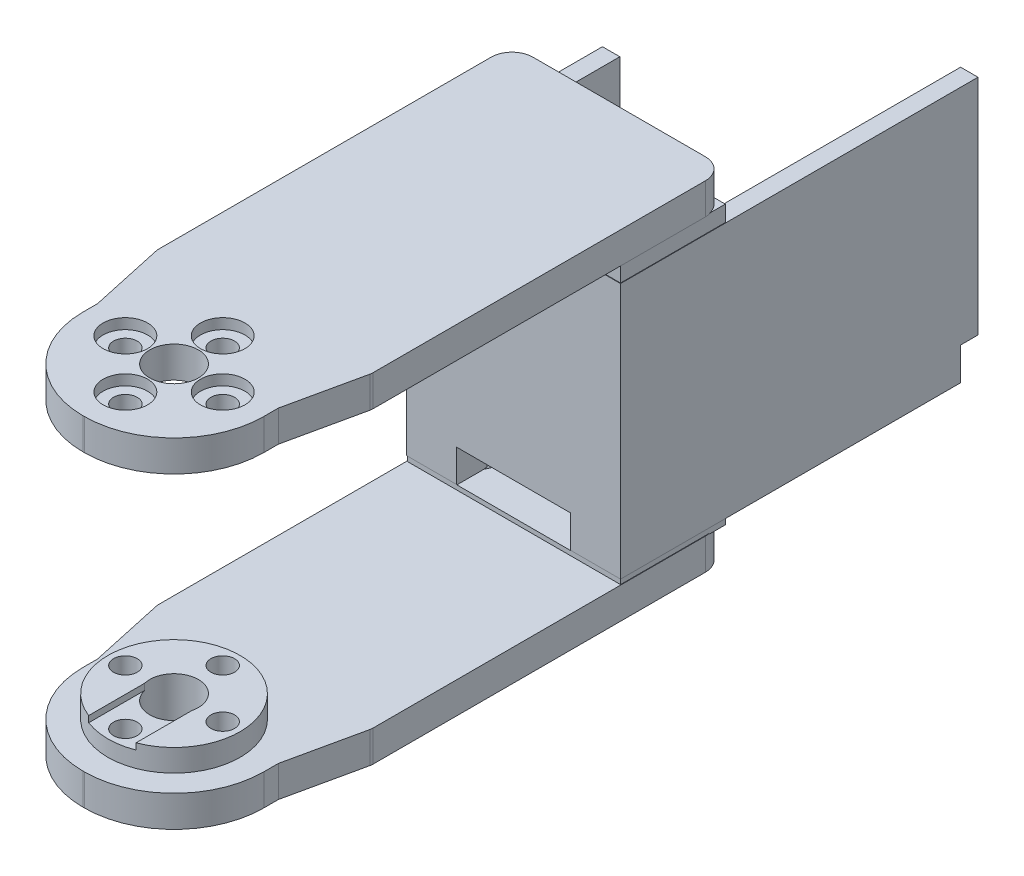
from build123d import *

# Parameters (mm, degrees)
BOSS_1_DEPTH    = 4.5
S_CYL2_R        = 9.5
BOSS_2_DEPTH    = 3.2
BOSS_3_DEPTH    = 4.5
S_BOX4_W        = 30.8
S_BOX4_H        = 36.8
BOSS_4_DEPTH    = 2.5
S_BOX5_W        = 2.5
S_BOX5_H        = 36.8
BOSS_5_DEPTH    = 51.4
S_BOX6_W        = 30.8
S_BOX6_H        = 4.6
BOSS_6_DEPTH    = 51.4
S_BOX7_W        = 2.5
S_BOX7_H        = 36.8
BOSS_7_DEPTH    = 28.2
S_BOX8_W        = 30.66
S_BOX8_H        = 2.4
BOSS_8_DEPTH    = 15.06
S_BOX9_W        = 30.66
S_BOX9_H        = 0.95
BOSS_9_DEPTH    = 15.06
S_HOLE10_R      = 3.5
HOLE_10_DEPTH   = 4.7
S_HOLE11_R      = 1.7
HOLE_11_DEPTH   = 4.7
S_HOLE12_R      = 1.7
HOLE_12_DEPTH   = 4.7
S_HOLE13_R      = 1.7
HOLE_13_DEPTH   = 4.7
S_HOLE14_R      = 1.7
HOLE_14_DEPTH   = 4.7
S_HOLE15_R      = 3.2
HOLE_15_DEPTH   = 1.6
S_HOLE16_R      = 3.2
HOLE_16_DEPTH   = 1.6
S_HOLE17_R      = 3.2
HOLE_17_DEPTH   = 1.6
S_HOLE18_R      = 3.2
HOLE_18_DEPTH   = 1.6
S_HOLE19_R      = 3.5
HOLE_19_DEPTH   = 7.9
S_HOLE20_R      = 1.7
HOLE_20_DEPTH   = 7.9
S_HOLE21_R      = 1.7
HOLE_21_DEPTH   = 7.9
S_HOLE22_R      = 1.7
HOLE_22_DEPTH   = 7.9
S_HOLE23_R      = 1.7
HOLE_23_DEPTH   = 7.9
S_HOLE24_R      = 3.2
HOLE_24_DEPTH   = 2.1
S_HOLE25_R      = 3.2
HOLE_25_DEPTH   = 2.1
S_HOLE26_R      = 3.2
HOLE_26_DEPTH   = 2.1
S_HOLE27_R      = 3.2
HOLE_27_DEPTH   = 2.1
S_CUT28_W       = 6.8
S_CUT28_H       = 1
POCKET_28_DEPTH = 10
S_HOLE29_R      = 10.5
HOLE_29_DEPTH   = 4.8
S_CUT30_W       = 19.4
S_CUT30_H       = 4.75
POCKET_30_DEPTH = 19.5
S_CUT31_W       = 16.4
S_CUT31_H       = 4.75
POCKET_31_DEPTH = 8.3
S_CUT32_W       = 7
S_CUT32_H       = 4.75
POCKET_32_DEPTH = 11
S_CUT33_W       = 20
S_CUT33_H       = 2.9
POCKET_33_DEPTH = 13.7
S_HOLE34_R      = 1.1
HOLE_34_DEPTH   = 4.8
S_HOLE35_R      = 2.3
HOLE_35_DEPTH   = 1.7
S_HOLE36_R      = 1.1
HOLE_36_DEPTH   = 4.8
S_HOLE37_R      = 2.3
HOLE_37_DEPTH   = 1.7
S_CUT38_W       = 31
S_CUT38_H       = 4.8
POCKET_38_DEPTH = 2.6
S_CUT39_W       = 19
S_CUT39_H       = 4.75
POCKET_39_DEPTH = 22.2
S_CUT40_W       = 15
S_CUT40_H       = 1.55
POCKET_40_DEPTH = 27.4
S_HOLE41_R      = 2.5
HOLE_41_DEPTH   = 5.3
S_HOLE42_R      = 2.5
HOLE_42_DEPTH   = 5.3


with BuildPart() as part:
    # S_prism1 → Boss_1 (new body)
    with BuildSketch(Plane(origin=(0, 18.8, 0), x_dir=(1, 0, 0), z_dir=(0, 1, 0))):
        with BuildLine():
            Line((-13, 2), (-15.354, 12.7893))
            ThreePointArc((-15.354, 12.7893), (-15.38850097, 13.001208985), (-15.4, 13.2156))
            Line((-15.4, 13.2156), (-15.4, 61))
            ThreePointArc((-15.4, 61), (-14.5213, 63.1213), (-12.4, 64))
            Line((-12.4, 64), (12.4, 64))
            ThreePointArc((12.4, 64), (14.5213, 63.1213), (15.4, 61))
            Line((15.4, 61), (15.4, 13.2156))
            ThreePointArc((15.4, 13.2156), (15.38850097, 13.001208985), (15.354, 12.7893))
            Line((15.354, 12.7893), (13, 2))
            Line((13, 2), (13, -0.1))
            ThreePointArc((13, -0.1), (9.2217, -9.2217), (0.1, -13))
            Line((0.1, -13), (-0.1, -13))
            ThreePointArc((-0.1, -13), (-9.2217, -9.2217), (-13, -0.1))
            Line((-13, -0.1), (-13, 2))
        make_face()
    extrude(amount=BOSS_1_DEPTH)



with BuildPart() as body_2:
    # S_cyl2 → Boss_2 (new body)
    with BuildSketch(Plane(origin=(0, -20.95, 0), x_dir=(1, 0, 0), z_dir=(0, 1, 0))):
        with Locations(Location((0, 0, 0), (0, 0, 270))):
            Circle(S_CYL2_R)
    extrude(amount=BOSS_2_DEPTH)

    # S_prism3 → Boss_3 (add)
    with BuildSketch(Plane(origin=(0, -25.45, 0), x_dir=(1, 0, 0), z_dir=(0, 1, 0))):
        with BuildLine():
            Line((-13, 2), (-15.354, 12.7893))
            ThreePointArc((-15.354, 12.7893), (-15.38850097, 13.001208985), (-15.4, 13.2156))
            Line((-15.4, 13.2156), (-15.4, 61))
            ThreePointArc((-15.4, 61), (-14.5213, 63.1213), (-12.4, 64))
            Line((-12.4, 64), (12.4, 64))
            ThreePointArc((12.4, 64), (14.5213, 63.1213), (15.4, 61))
            Line((15.4, 61), (15.4, 13.2156))
            ThreePointArc((15.4, 13.2156), (15.38850097, 13.001208985), (15.354, 12.7893))
            Line((15.354, 12.7893), (13, 2))
            Line((13, 2), (13, -0.1))
            ThreePointArc((13, -0.1), (9.2217, -9.2217), (0.1, -13))
            Line((0.1, -13), (-0.1, -13))
            ThreePointArc((-0.1, -13), (-9.2217, -9.2217), (-13, -0.1))
            Line((-13, -0.1), (-13, 2))
        make_face()
    extrude(amount=BOSS_3_DEPTH)


with BuildPart() as body_3:
    # S_box4 → Boss_4 (new body)
    with BuildSketch(Plane.XY.offset(-51.3)):
        with Locations((0, -1.8)):
            Rectangle(S_BOX4_W, S_BOX4_H)
    extrude(amount=BOSS_4_DEPTH)

    # S_box5 → Boss_5 (add)
    with BuildSketch(Plane.XY.offset(-100.2)):
        with Locations((14.15, -1.8)):
            Rectangle(S_BOX5_W, S_BOX5_H)
    extrude(amount=BOSS_5_DEPTH)

    # S_box6 → Boss_6 (add)
    with BuildSketch(Plane.XY.offset(-100.2)):
        with Locations((0, -17.9)):
            Rectangle(S_BOX6_W, S_BOX6_H)
    extrude(amount=BOSS_6_DEPTH)

    # S_box7 → Boss_7 (add)
    with BuildSketch(Plane.XY.offset(-77)):
        with Locations((-14.15, -1.8)):
            Rectangle(S_BOX7_W, S_BOX7_H)
    extrude(amount=BOSS_7_DEPTH)


with BuildPart() as part_1:
    add(part.part)

    add(body_3.part)  # Boss_8 merges body 3
    # S_box8 → Boss_8 (add)
    with BuildSketch(Plane.XY.offset(-63.93)):
        with Locations((0, 17.7)):
            Rectangle(S_BOX8_W, S_BOX8_H)
    extrude(amount=BOSS_8_DEPTH)


    add(body_2.part)  # Boss_9 merges body 2
    # S_box9 → Boss_9 (add)
    with BuildSketch(Plane.XY.offset(-63.93)):
        with Locations((0, -20.575)):
            Rectangle(S_BOX9_W, S_BOX9_H)
    extrude(amount=BOSS_9_DEPTH)

    # S_hole10 → Hole_10 (cut)
    with BuildSketch(Plane(origin=(0, 18.7, 0), x_dir=(1, 0, 0), z_dir=(0, 1, 0))):
        with Locations(Location((0, 0, 0), (0, 0, 90))):
            Circle(S_HOLE10_R)
    extrude(amount=HOLE_10_DEPTH, mode=Mode.SUBTRACT)

    # S_hole11 → Hole_11 (cut)
    with BuildSketch(Plane(origin=(0, 18.7, 0), x_dir=(1, 0, 0), z_dir=(0, 1, 0))):
        with Locations(Location((7, 0, 0), (0, 0, 90))):
            Circle(S_HOLE11_R)
    extrude(amount=HOLE_11_DEPTH, mode=Mode.SUBTRACT)

    # S_hole12 → Hole_12 (cut)
    with BuildSketch(Plane(origin=(0, 18.7, 0), x_dir=(1, 0, 0), z_dir=(0, 1, 0))):
        with Locations(Location((0, -7, 0), (0, 0, 90))):
            Circle(S_HOLE12_R)
    extrude(amount=HOLE_12_DEPTH, mode=Mode.SUBTRACT)

    # S_hole13 → Hole_13 (cut)
    with BuildSketch(Plane(origin=(0, 18.7, 0), x_dir=(1, 0, 0), z_dir=(0, 1, 0))):
        with Locations(Location((-7, 0, 0), (0, 0, 90))):
            Circle(S_HOLE13_R)
    extrude(amount=HOLE_13_DEPTH, mode=Mode.SUBTRACT)

    # S_hole14 → Hole_14 (cut)
    with BuildSketch(Plane(origin=(0, 18.7, 0), x_dir=(1, 0, 0), z_dir=(0, 1, 0))):
        with Locations(Location((0, 7, 0), (0, 0, 90))):
            Circle(S_HOLE14_R)
    extrude(amount=HOLE_14_DEPTH, mode=Mode.SUBTRACT)

    # S_hole15 → Hole_15 (cut)
    with BuildSketch(Plane(origin=(0, 21.8, 0), x_dir=(1, 0, 0), z_dir=(0, 1, 0))):
        with Locations(Location((7, 0, 0), (0, 0, 90))):
            Circle(S_HOLE15_R)
    extrude(amount=HOLE_15_DEPTH, mode=Mode.SUBTRACT)

    # S_hole16 → Hole_16 (cut)
    with BuildSketch(Plane(origin=(0, 21.8, 0), x_dir=(1, 0, 0), z_dir=(0, 1, 0))):
        with Locations(Location((0, -7, 0), (0, 0, 90))):
            Circle(S_HOLE16_R)
    extrude(amount=HOLE_16_DEPTH, mode=Mode.SUBTRACT)

    # S_hole17 → Hole_17 (cut)
    with BuildSketch(Plane(origin=(0, 21.8, 0), x_dir=(1, 0, 0), z_dir=(0, 1, 0))):
        with Locations(Location((-7, 0, 0), (0, 0, 90))):
            Circle(S_HOLE17_R)
    extrude(amount=HOLE_17_DEPTH, mode=Mode.SUBTRACT)

    # S_hole18 → Hole_18 (cut)
    with BuildSketch(Plane(origin=(0, 21.8, 0), x_dir=(1, 0, 0), z_dir=(0, 1, 0))):
        with Locations(Location((0, 7, 0), (0, 0, 90))):
            Circle(S_HOLE18_R)
    extrude(amount=HOLE_18_DEPTH, mode=Mode.SUBTRACT)

    # S_hole19 → Hole_19 (cut)
    with BuildSketch(Plane(origin=(0, -25.55, 0), x_dir=(1, 0, 0), z_dir=(0, 1, 0))):
        with Locations(Location((0, 0, 0), (0, 0, 90))):
            Circle(S_HOLE19_R)
    extrude(amount=HOLE_19_DEPTH, mode=Mode.SUBTRACT)

    # S_hole20 → Hole_20 (cut)
    with BuildSketch(Plane(origin=(0, -25.55, 0), x_dir=(1, 0, 0), z_dir=(0, 1, 0))):
        with Locations(Location((7, 0, 0), (0, 0, 90))):
            Circle(S_HOLE20_R)
    extrude(amount=HOLE_20_DEPTH, mode=Mode.SUBTRACT)

    # S_hole21 → Hole_21 (cut)
    with BuildSketch(Plane(origin=(0, -25.55, 0), x_dir=(1, 0, 0), z_dir=(0, 1, 0))):
        with Locations(Location((0, -7, 0), (0, 0, 90))):
            Circle(S_HOLE21_R)
    extrude(amount=HOLE_21_DEPTH, mode=Mode.SUBTRACT)

    # S_hole22 → Hole_22 (cut)
    with BuildSketch(Plane(origin=(0, -25.55, 0), x_dir=(1, 0, 0), z_dir=(0, 1, 0))):
        with Locations(Location((-7, 0, 0), (0, 0, 90))):
            Circle(S_HOLE22_R)
    extrude(amount=HOLE_22_DEPTH, mode=Mode.SUBTRACT)

    # S_hole23 → Hole_23 (cut)
    with BuildSketch(Plane(origin=(0, -25.55, 0), x_dir=(1, 0, 0), z_dir=(0, 1, 0))):
        with Locations(Location((0, 7, 0), (0, 0, 90))):
            Circle(S_HOLE23_R)
    extrude(amount=HOLE_23_DEPTH, mode=Mode.SUBTRACT)

    # S_hole24 → Hole_24 (cut)
    with BuildSketch(Plane(origin=(0, -25.55, 0), x_dir=(1, 0, 0), z_dir=(0, 1, 0))):
        with Locations(Location((7, 0, 0), (0, 0, 90))):
            Circle(S_HOLE24_R)
    extrude(amount=HOLE_24_DEPTH, mode=Mode.SUBTRACT)

    # S_hole25 → Hole_25 (cut)
    with BuildSketch(Plane(origin=(0, -25.55, 0), x_dir=(1, 0, 0), z_dir=(0, 1, 0))):
        with Locations(Location((0, -7, 0), (0, 0, 90))):
            Circle(S_HOLE25_R)
    extrude(amount=HOLE_25_DEPTH, mode=Mode.SUBTRACT)

    # S_hole26 → Hole_26 (cut)
    with BuildSketch(Plane(origin=(0, -25.55, 0), x_dir=(1, 0, 0), z_dir=(0, 1, 0))):
        with Locations(Location((-7, 0, 0), (0, 0, 90))):
            Circle(S_HOLE26_R)
    extrude(amount=HOLE_26_DEPTH, mode=Mode.SUBTRACT)

    # S_hole27 → Hole_27 (cut)
    with BuildSketch(Plane(origin=(0, -25.55, 0), x_dir=(1, 0, 0), z_dir=(0, 1, 0))):
        with Locations(Location((0, 7, 0), (0, 0, 90))):
            Circle(S_HOLE27_R)
    extrude(amount=HOLE_27_DEPTH, mode=Mode.SUBTRACT)

    # S_cut28 → Pocket_28 (cut)
    with BuildSketch(Plane.XY):
        with Locations((0, -18.15)):
            Rectangle(S_CUT28_W, S_CUT28_H)
    extrude(amount=POCKET_28_DEPTH, mode=Mode.SUBTRACT)

    # S_hole29 → Hole_29 (cut)
    with BuildSketch(Plane(origin=(0, -20.3, 0), x_dir=(1, 0, 0), z_dir=(0, 1, 0))):
        with Locations(Location((0, 87, 0), (0, 0, 90))):
            Circle(S_HOLE29_R)
    extrude(amount=HOLE_29_DEPTH, mode=Mode.SUBTRACT)

    # S_cut30 → Pocket_30 (cut)
    with BuildSketch(Plane.XY.offset(-76.1)):
        with Locations((0, -17.925)):
            Rectangle(S_CUT30_W, S_CUT30_H)
    extrude(amount=POCKET_30_DEPTH, mode=Mode.SUBTRACT)

    # S_cut31 → Pocket_31 (cut)
    with BuildSketch(Plane.XY.offset(-56.6)):
        with Locations((0, -17.925)):
            Rectangle(S_CUT31_W, S_CUT31_H)
    extrude(amount=POCKET_31_DEPTH, mode=Mode.SUBTRACT)

    # S_cut32 → Pocket_32 (cut)
    with BuildSketch(Plane.XY.offset(-87)):
        with Locations((0, -17.925)):
            Rectangle(S_CUT32_W, S_CUT32_H)
    extrude(amount=POCKET_32_DEPTH, mode=Mode.SUBTRACT)

    # S_cut33 → Pocket_33 (cut)
    with BuildSketch(Plane.XY.offset(-100.7)):
        with Locations((0, -18.95)):
            Rectangle(S_CUT33_W, S_CUT33_H)
    extrude(amount=POCKET_33_DEPTH, mode=Mode.SUBTRACT)

    # S_hole34 → Hole_34 (cut)
    with BuildSketch(Plane(origin=(0, -20.3, 0), x_dir=(1, 0, 0), z_dir=(0, 1, 0))):
        with Locations(Location((-10.25, 54.25, 0), (0, 0, 90))):
            Circle(S_HOLE34_R)
    extrude(amount=HOLE_34_DEPTH, mode=Mode.SUBTRACT)

    # S_hole35 → Hole_35 (cut)
    with BuildSketch(Plane(origin=(0, -20.3, 0), x_dir=(1, 0, 0), z_dir=(0, 1, 0))):
        with Locations((-10.25, 54.25)):
            Circle(S_HOLE35_R)
    extrude(amount=HOLE_35_DEPTH, mode=Mode.SUBTRACT)

    # S_hole36 → Hole_36 (cut)
    with BuildSketch(Plane(origin=(0, -20.3, 0), x_dir=(1, 0, 0), z_dir=(0, 1, 0))):
        with Locations(Location((10.25, 54.25, 0), (0, 0, 90))):
            Circle(S_HOLE36_R)
    extrude(amount=HOLE_36_DEPTH, mode=Mode.SUBTRACT)

    # S_hole37 → Hole_37 (cut)
    with BuildSketch(Plane(origin=(0, -20.3, 0), x_dir=(1, 0, 0), z_dir=(0, 1, 0))):
        with Locations((10.25, 54.25)):
            Circle(S_HOLE37_R)
    extrude(amount=HOLE_37_DEPTH, mode=Mode.SUBTRACT)

    # S_cut38 → Pocket_38 (cut)
    with BuildSketch(Plane.XY.offset(-100.3)):
        with Locations((0, -17.9)):
            Rectangle(S_CUT38_W, S_CUT38_H)
    extrude(amount=POCKET_38_DEPTH, mode=Mode.SUBTRACT)

    # S_cut39 → Pocket_39 (cut)
    with BuildSketch(Plane.XY.offset(-97.8)):
        with Locations((0, -17.925)):
            Rectangle(S_CUT39_W, S_CUT39_H)
    extrude(amount=POCKET_39_DEPTH, mode=Mode.SUBTRACT)

    # S_cut40 → Pocket_40 (cut)
    with BuildSketch(Plane.XY.offset(-78.9)):
        with Locations((0, 16.975)):
            Rectangle(S_CUT40_W, S_CUT40_H)
    extrude(amount=POCKET_40_DEPTH, mode=Mode.SUBTRACT)

    # S_hole41 → Hole_41 (cut)
    with BuildSketch(Plane(origin=(0, -25.55, 0), x_dir=(1, 0, 0), z_dir=(0, 1, 0))):
        with Locations(Location((-10.25, 54.25, 0), (0, 0, 90))):
            Circle(S_HOLE41_R)
    extrude(amount=HOLE_41_DEPTH, mode=Mode.SUBTRACT)

    # S_hole42 → Hole_42 (cut)
    with BuildSketch(Plane(origin=(0, -25.55, 0), x_dir=(1, 0, 0), z_dir=(0, 1, 0))):
        with Locations(Location((10.25, 54.25, 0), (0, 0, 90))):
            Circle(S_HOLE42_R)
    extrude(amount=HOLE_42_DEPTH, mode=Mode.SUBTRACT)


solid = part_1.part
